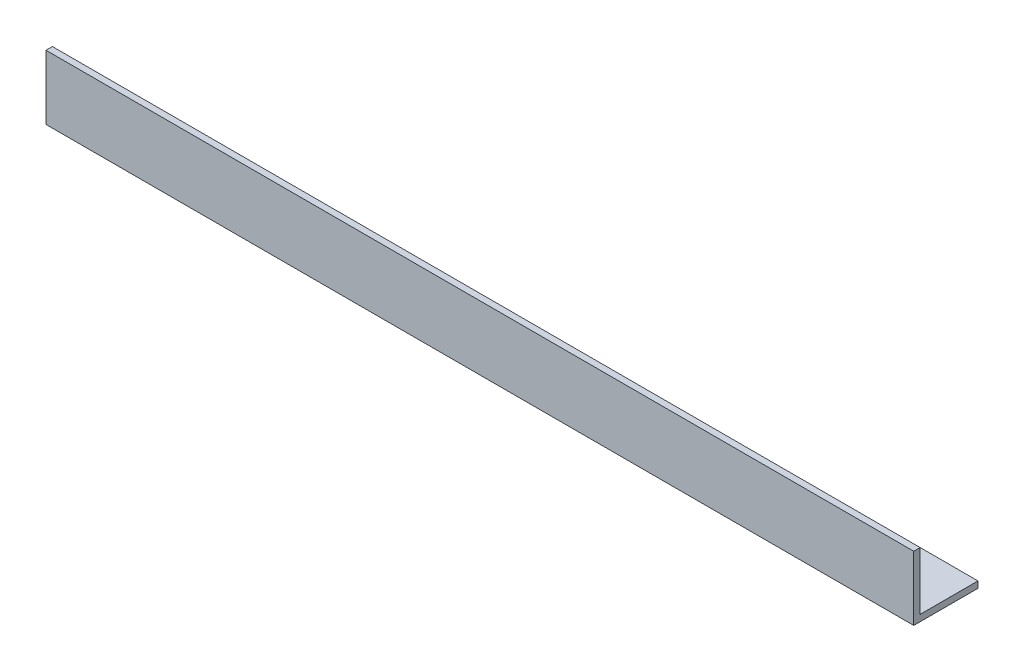
from build123d import *

# Parameters (mm, degrees)
BOSS_EXTRUDE1_DEPTH = 270


with BuildPart() as part:
    # Sketch1 → Boss-Extrude1 (new body)
    with BuildSketch(Plane(origin=(0, 0, 0), x_dir=(0, 0, -1), z_dir=(1, 0, 0))):
        Polygon((0, 20), (0, 0), (20, 0), (20, 2), (2, 2), (2, 20), align=None)
    extrude(amount=BOSS_EXTRUDE1_DEPTH)


solid = part.part
